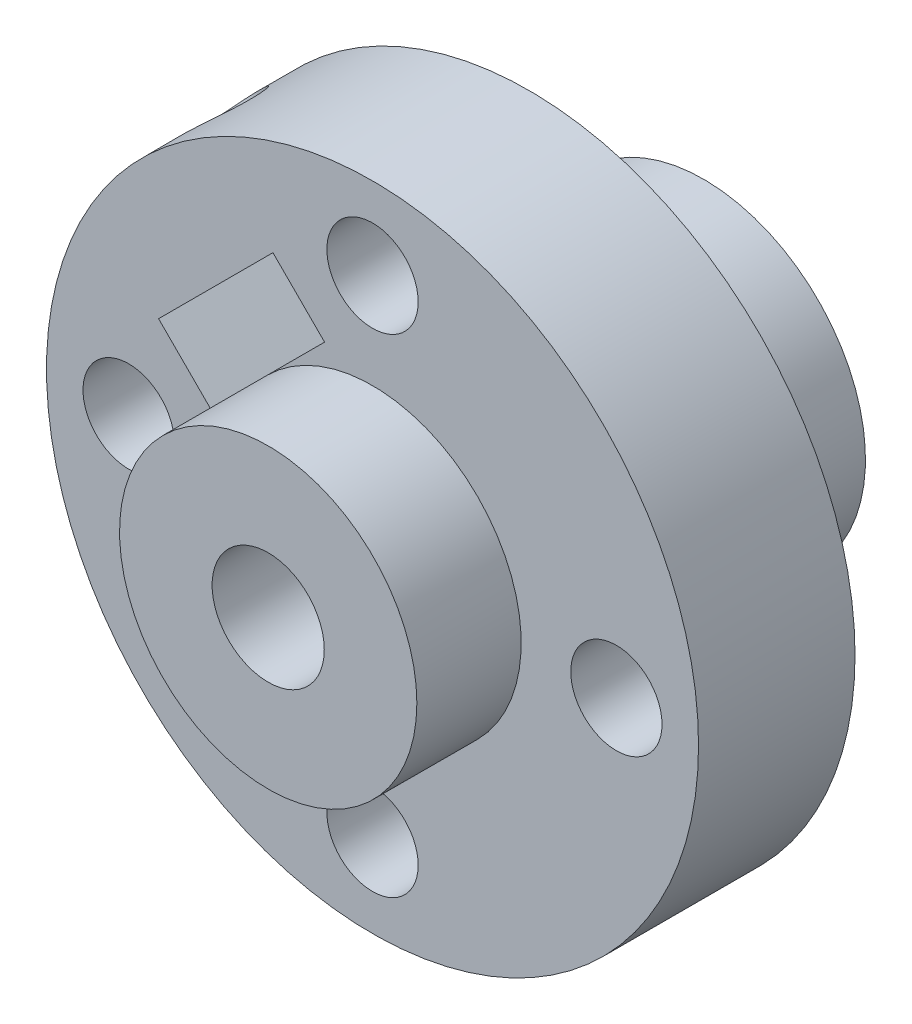
from build123d import *

# Parameters (mm, degrees)
ESBO_O1_R                         = 12.5
RESSALTO_EXTRUS_O1_DEPTH          = 6
ESBO_O5_R                         = 6.2
RESSALTO_EXTRUS_O2_DEPTH          = 6.7
ESBO_O6_R                         = 5.7
RESSALTO_EXTRUS_O3_DEPTH          = 4
ESBO_O7_R                         = 2.15
CORTE_EXTRUS_O1_DEPTH             = 13.95
ESBO_O10_R                        = 1.75
CORTE_EXTRUS_O2_DEPTH             = 65.724771281
CORTE_EXTRUS_O3_DEPTH             = 6
CORTE_EXTRUS_O4_REACH             = 31.83
ESBO_O12_R                        = 1.5
CORTE_EXTRUS_O4_DIRECTION_2_REACH = 31.83


with BuildPart() as part:
    # Esboço1 → Ressalto-extrusão1 (new body)
    with BuildSketch(Plane.XY):
        with Locations(Location((-38.354525113, 25.471348315, 0), (0, 0, 180))):
            Circle(ESBO_O1_R)
    extrude(amount=RESSALTO_EXTRUS_O1_DEPTH)

    # Esboço5 → Ressalto-extrusão2 (add)
    with BuildSketch(Plane(origin=(0, 0, 0), x_dir=(-1, 0, 0), z_dir=(0, 0, -1))):
        with Locations(Location((38.354525113, 25.471348315, 0), (0, 0, 180))):
            Circle(ESBO_O5_R)
    extrude(amount=RESSALTO_EXTRUS_O2_DEPTH)

    # Esboço6 → Ressalto-extrusão3 (add)
    with BuildSketch(Plane.XY.offset(6)):
        with Locations((-38.354525113, 25.471348315)):
            Circle(ESBO_O6_R)
    extrude(amount=RESSALTO_EXTRUS_O3_DEPTH)

    # Esboço7 → Corte-extrusão1 (cut)
    with BuildSketch(Plane.XY.offset(10)):
        with Locations((-38.354525113, 25.471348315)):
            Circle(ESBO_O7_R)
    extrude(amount=-CORTE_EXTRUS_O1_DEPTH, mode=Mode.SUBTRACT)

    # Esboço10 → Corte-extrusão2 (cut, through all)
    with BuildSketch(Plane.XY.offset(6)):
        with Locations((-38.354525113, 34.821348315)):
            Circle(ESBO_O10_R)
        with Locations((-38.354525113, 16.121348315)):
            Circle(ESBO_O10_R)
        with Locations((-29.004525113, 25.471348315)):
            Circle(ESBO_O10_R)
        with Locations((-47.704525113, 25.471348315)):
            Circle(ESBO_O10_R)
    extrude(amount=-CORTE_EXTRUS_O2_DEPTH, mode=Mode.SUBTRACT)

    # Esboço9 → Corte-extrusão3 (cut)
    with BuildSketch(Plane.XY.offset(6)):
        Polygon((-44.577064788, 27.309825946), (-40.193002744, 31.693887989), (-42.172901732, 33.673786976), (-46.556963775, 29.289724933), align=None)
    extrude(amount=-CORTE_EXTRUS_O3_DEPTH, mode=Mode.SUBTRACT)

    # Esboço12 → Corte-extrusão4 (cut, up to next)
    with BuildSketch(Plane(origin=(-37.923344354, 37.923344354, 0), x_dir=(0, 0, -1), z_dir=(0.7071067811865457, -0.7071067811865493, 0)), mode=Mode.PRIVATE) as corte_extrus_o4_sk1:
        with Locations(Location((-3, -9.109781678, 0), (0, 0, 270))):
            Circle(ESBO_O12_R)
    corte_extrus_o4_tool1 = extrude(corte_extrus_o4_sk1.sketch, amount=-CORTE_EXTRUS_O4_REACH, mode=Mode.PRIVATE) & part.part
    add(corte_extrus_o4_tool1.solids().sort_by_distance((-44.364933, 31.481756, 3))[0], mode=Mode.SUBTRACT)

    # Esboço12 → Corte-extrusão4 direction 2 (cut, up to next)
    with BuildSketch(Plane(origin=(-37.923344354, 37.923344354, 0), x_dir=(0, 0, -1), z_dir=(0.7071067811865457, -0.7071067811865493, 0)), mode=Mode.PRIVATE) as corte_extrus_o4_direction_2_sk1:
        with Locations(Location((-3, -9.109781678, 0), (0, 0, 270))):
            Circle(ESBO_O12_R)
    corte_extrus_o4_direction_2_tool1 = extrude(corte_extrus_o4_direction_2_sk1.sketch, amount=CORTE_EXTRUS_O4_DIRECTION_2_REACH, mode=Mode.PRIVATE) & part.part
    add(corte_extrus_o4_direction_2_tool1.solids().sort_by_distance((-44.364933, 31.481756, 3))[0], mode=Mode.SUBTRACT)


solid = part.part
